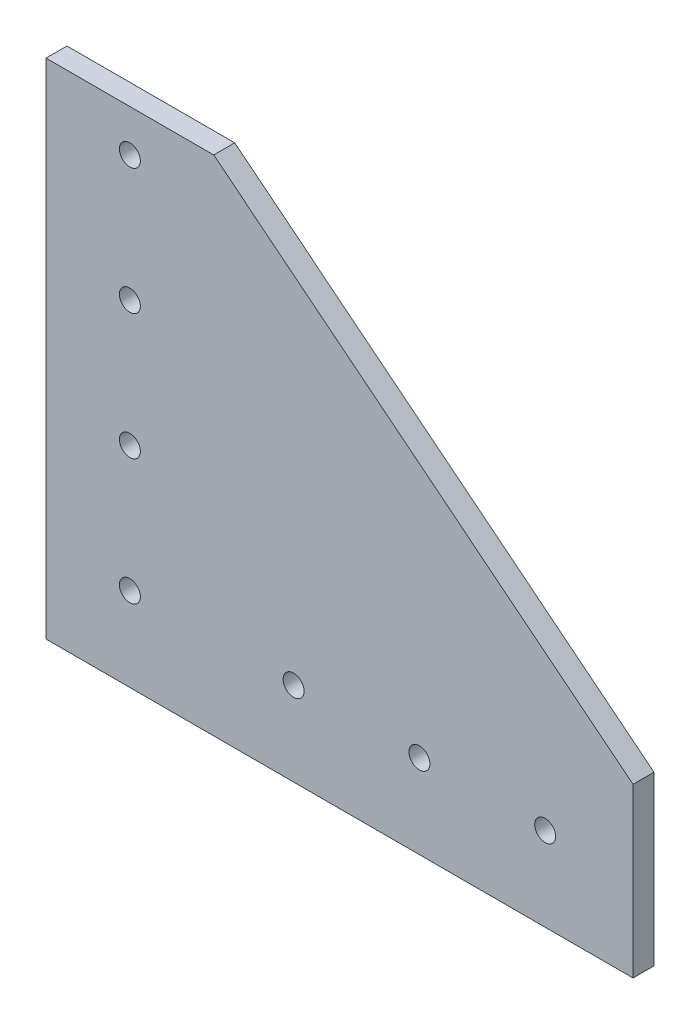
from build123d import *

# Parameters (mm, degrees)
BOSS_EXTRUDE1_DEPTH = 3.175
SKETCH2_R           = 1.5875
CUT_EXTRUDE1_DEPTH  = 64.286370995


with BuildPart() as part:
    # Sketch1 → Boss-Extrude1 (new body)
    with BuildSketch(Plane.XY):
        Polygon((40.909912505, -35.06563929), (40.909912505, -9.66563929), (-22.590087495, 41.13436071), (-47.990087495, 41.13436071), (-47.990087495, -35.06563929), align=None)
    extrude(amount=BOSS_EXTRUDE1_DEPTH)

    # Sketch2 → Cut-Extrude1 (cut, through all)
    with BuildSketch(Plane(origin=(0, 0, 0), x_dir=(-1, 0, 0), z_dir=(0, 0, -1))):
        with Locations((35.290087495, -22.36563929)):
            Circle(SKETCH2_R)
        with Locations((35.290087495, -3.31563929)):
            Circle(SKETCH2_R)
        with Locations((35.290087495, 15.73436071)):
            Circle(SKETCH2_R)
        with Locations((35.290087495, 34.78436071)):
            Circle(SKETCH2_R)
        with Locations((10.494914026, -22.36563929)):
            Circle(SKETCH2_R)
        with Locations((-8.555085974, -22.36563929)):
            Circle(SKETCH2_R)
        with Locations((-27.605085974, -22.36563929)):
            Circle(SKETCH2_R)
    extrude(amount=-CUT_EXTRUDE1_DEPTH, mode=Mode.SUBTRACT)


solid = part.part
